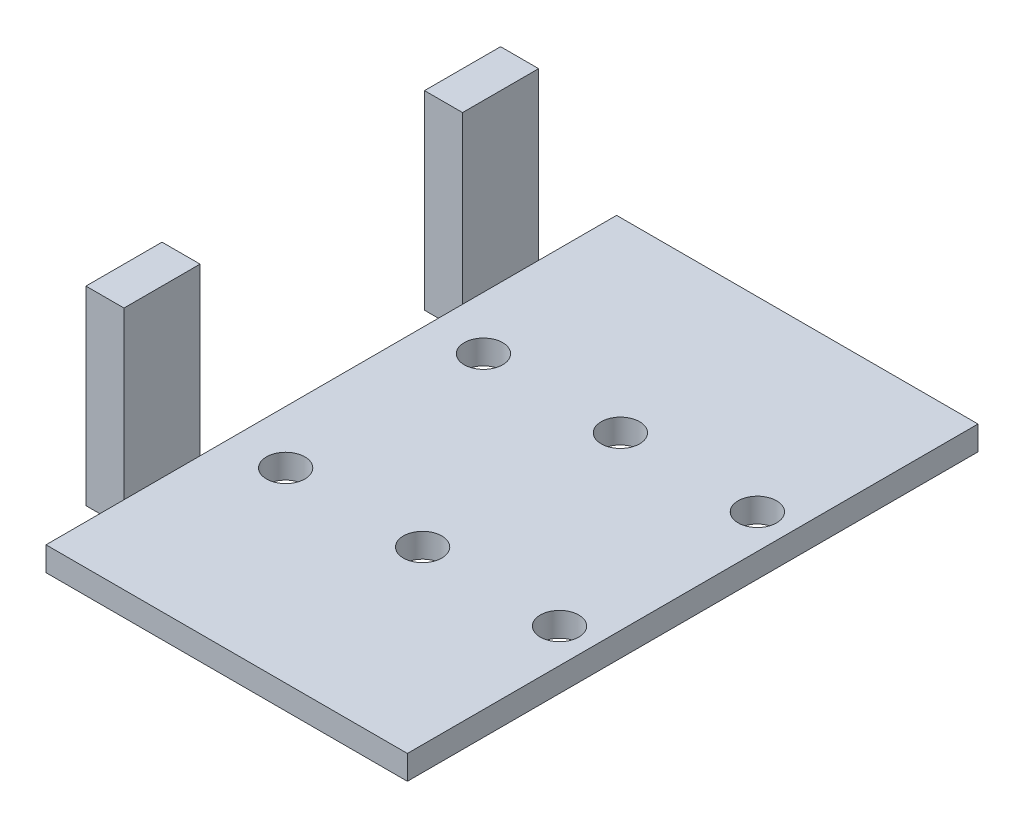
from build123d import *

# Parameters (mm, degrees)
SKETCH1_R           = 5.05
BOSS_EXTRUDE1_DEPTH = 6.35
SKETCH2_W           = 10
SKETCH2_H           = 20
BOSS_EXTRUDE2_DEPTH = 50


with BuildPart() as part:
    # Sketch1 → Boss-Extrude1 (new body)
    with BuildSketch(Plane(origin=(0, 0, 0), x_dir=(1, 0, 0), z_dir=(0, 1, 0))):
        Polygon((45, 75), (-50, 75), (-50, 67.7), (-50, 47.7), (-50, -47.7), (-50, -67.7), (-50, -75), (45, -75), align=None)
        with Locations(Location((-36, 26, 0), (0, 0, 270))):
            Circle(SKETCH1_R, mode=Mode.SUBTRACT)
        with Locations(Location((36, 26, 0), (0, 0, 270))):
            Circle(SKETCH1_R, mode=Mode.SUBTRACT)
        with Locations(Location((36, -26, 0), (0, 0, 270))):
            Circle(SKETCH1_R, mode=Mode.SUBTRACT)
        with Locations(Location((-36, -26, 0), (0, 0, 270))):
            Circle(SKETCH1_R, mode=Mode.SUBTRACT)
        with Locations(Location((0, 26, 0), (0, 0, 270))):
            Circle(SKETCH1_R, mode=Mode.SUBTRACT)
        with Locations(Location((0, -26, 0), (0, 0, 270))):
            Circle(SKETCH1_R, mode=Mode.SUBTRACT)
    extrude(amount=BOSS_EXTRUDE1_DEPTH)

    # Sketch2 → Boss-Extrude2 (add)
    with BuildSketch(Plane(origin=(0, 0, 0), x_dir=(1, 0, 0), z_dir=(0, 1, 0))):
        with Locations((-55, 44.5)):
            Rectangle(SKETCH2_W, SKETCH2_H)
        with Locations((-55, -44.5)):
            Rectangle(SKETCH2_W, SKETCH2_H)
    extrude(amount=BOSS_EXTRUDE2_DEPTH)


solid = part.part
